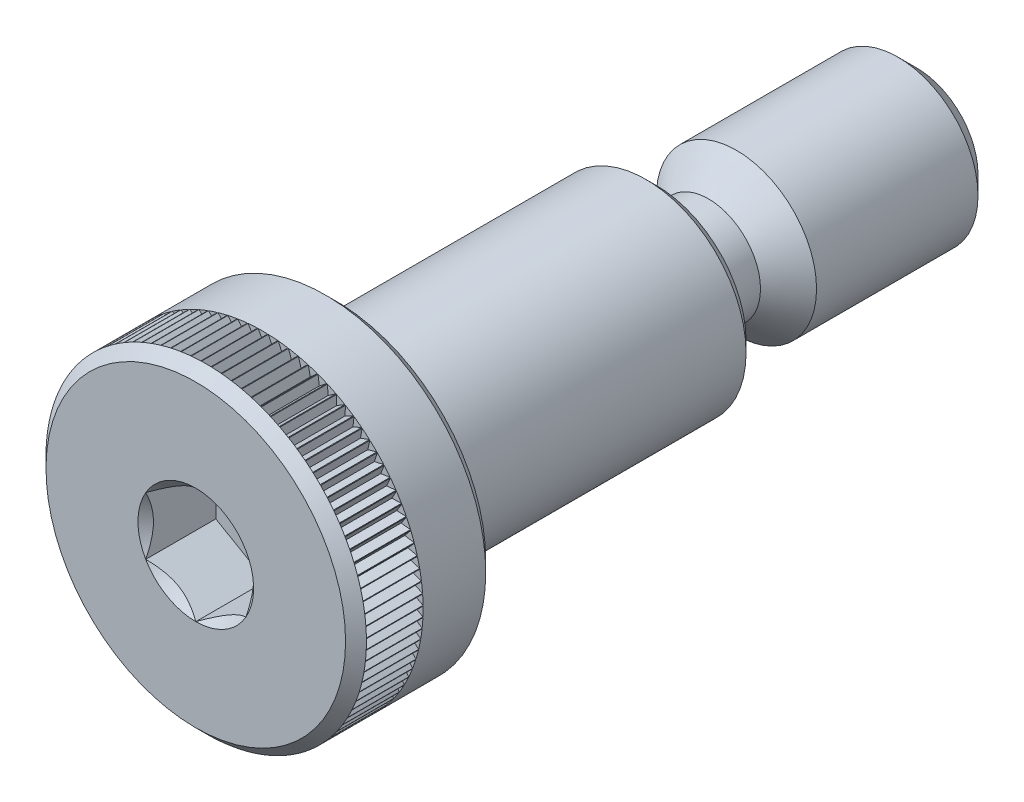
from build123d import *

# Parameters (mm, degrees)
CUT_EXTRUDE1_START = 18
CUT_EXTRUDE1_DEPTH = 3.5
CHAMFER1_SIZE      = 0.52
CUT_EXTRUDE3_START = 17.48
CUT_EXTRUDE3_DEPTH = 2.831
CIRPATTERN1_COUNT  = 99


with BuildPart() as part:
    # Sketch3 → Revolve1 (revolve)
    with BuildSketch(Plane(origin=(0, 0, 0), x_dir=(0, 0, -1), z_dir=(1, 0, 0)), mode=Mode.PRIVATE) as revolve1_sk:
        with BuildLine():
            Line((-18, 0), (-18, 7.48))
            Line((-18, 7.48), (-17.48, 8))
            Line((-17.48, 8), (-11.52, 8))
            Line((-11.52, 8), (-11, 7.48))
            Line((-11, 7.48), (-11, 4.797))
            Line((-11, 4.797), (-10.492, 4.797))
            Line((-10.492, 4.797), (-10.289, 5))
            Line((-10.289, 5), (5, 5))
            Line((5, 5), (5, 3.3))
            ThreePointArc((5, 3.3), (5.205025253, 2.805025253), (5.7, 2.6))
            Line((5.7, 2.6), (7.6, 2.6))
            Line((7.6, 2.6), (9, 4))
            Line((9, 4), (17.0625, 4))
            Line((17.0625, 4), (18, 3.0625))
            Line((18, 3.0625), (18, 0))
            Line((18, 0), (-18, 0))
        make_face()
    revolve(revolve1_sk.sketch.rotate(Axis((0, 0, 18), (0, 0, -1)), 90), axis=Axis((0, 0, 18), (0, 0, -1)))

    # Sketch4 → Cut-Extrude1 (cut)
    with BuildSketch(Plane.XY.offset(CUT_EXTRUDE1_START)):
        Polygon((0, 2.886751346), (-2.5, 1.443375673), (-2.5, -1.443375673), (0, -2.886751346), (2.5, -1.443375673), (2.5, 1.443375673), align=None)
    extrude(amount=-CUT_EXTRUDE1_DEPTH, mode=Mode.SUBTRACT)

    # Cut-Extrude2 cone 1 section (through the dimple's axis) → Cut-Extrude2 (revolve, cut)
    with BuildSketch(Plane(origin=(0, 0, 18), x_dir=(0, -1, 0), z_dir=(1, 0, 0))):
        Polygon((0, 0), (2.886751346, 0), (0, 2.886751346), align=None)
    revolve(axis=Axis((0, 0, 18), (0, 0, -1)), mode=Mode.SUBTRACT)

    # Chamfer1
    chamfer1_edges = [part.edges().sort_by_distance(p)[0] for p in [
        (-5, 0, -5),
    ]]
    chamfer(chamfer1_edges, length=CHAMFER1_SIZE)

    # Sketch8 → Cut-Extrude3 (cut)
    with BuildSketch(Plane.XY.offset(CUT_EXTRUDE3_START)):
        Polygon((-0.240177712, 8), (0.240177712, 8), (0, 7.584), align=None)
    cut_extrude3 = extrude(amount=-CUT_EXTRUDE3_DEPTH, mode=Mode.SUBTRACT)

    # CirPattern1: Cut-Extrude3 ×99 about axis
    cirpattern1_axis = Axis((0, 0, 0), (0, 0, 1))
    for i in range(1, CIRPATTERN1_COUNT):
        add(cut_extrude3.rotate(cirpattern1_axis, i * 360 / CIRPATTERN1_COUNT), mode=Mode.SUBTRACT)


solid = part.part
